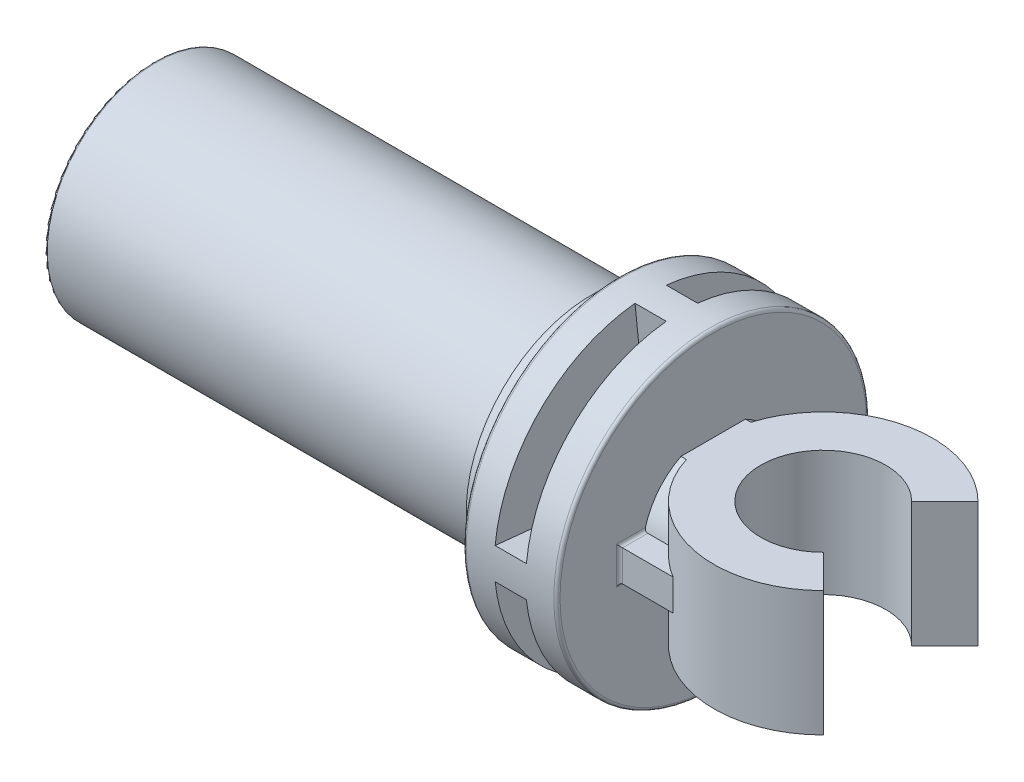
from build123d import *
from build123d.topology import SkipClean

# Parameters (mm, degrees)
SCHIZZO1_R                    = 3.5
ESTRUSIONE_ESTRUSIONE1_DEPTH  = 14
SCHIZZO2_R                    = 4
ESTRUSIONE_ESTRUSIONE2_DEPTH  = 0.9
SCHIZZO3_R                    = 5
ESTRUSIONE_ESTRUSIONE3_DEPTH  = 1
SCHIZZO4_R                    = 3.5
ESTRUSIONE_ESTRUSIONE4_DEPTH  = 1
SCHIZZO5_R                    = 5
ESTRUSIONE_ESTRUSIONE5_DEPTH  = 1
SCHIZZO6_W                    = 1
SCHIZZO6_H                    = 2
RIVOLUZIONE1_ANGLE            = 11.5
RIPETIZIONECIRCOLARE1_COUNT   = 4
SCHIZZO8_R                    = 3
TAGLIO_ESTRUSIONE2_DEPTH      = 14.9
SCHIZZO10_W                   = 10.9
SCHIZZO10_H                   = 2
TAGLIO_ESTRUSIONE3_DEPTH      = 20.246038553
SCHIZZO11_R                   = 2
TAGLIO_ESTRUSIONE5_DEPTH      = 1
SCHIZZO12_R                   = 2.25
ESTRUSIONE_ESTRUSIONE14_DEPTH = 1
ESTRUSIONE_ESTRUSIONE18_DEPTH = 2
ESTRUSIONE_ESTRUSIONE15_DEPTH = 0.5
SCHIZZO15_W                   = 1
SCHIZZO15_H                   = 2.061552812
TAGLIO_ESTRUSIONE6_DEPTH      = 1
RACCORDO1_R                   = 0.1
RACCORDO4_R                   = 0.1
RACCORDO5_R                   = 0.1
RACCORDO6_R                   = 0.1
RACCORDO7_R                   = 0.1


with BuildPart() as part:
    # Schizzo1 → Estrusione-Estrusione1 (new body)
    with BuildSketch(Plane(origin=(0, 0, 0), x_dir=(0, 0, -1), z_dir=(1, 0, 0))):
        Circle(SCHIZZO1_R)
    extrude(amount=ESTRUSIONE_ESTRUSIONE1_DEPTH)

    # Schizzo2 → Estrusione-Estrusione2 (add)
    with BuildSketch(Plane(origin=(14, 0, 0), x_dir=(0, 0, -1), z_dir=(1, 0, 0))):
        Circle(SCHIZZO2_R)
    extrude(amount=ESTRUSIONE_ESTRUSIONE2_DEPTH)

    # Schizzo3 → Estrusione-Estrusione3 (add)
    with BuildSketch(Plane(origin=(14.9, 0, 0), x_dir=(0, 0, -1), z_dir=(1, 0, 0))):
        Circle(SCHIZZO3_R)
    extrude(amount=ESTRUSIONE_ESTRUSIONE3_DEPTH)

    # Schizzo4 → Estrusione-Estrusione4 (add)
    with BuildSketch(Plane(origin=(15.9, 0, 0), x_dir=(0, 0, -1), z_dir=(1, 0, 0))):
        Circle(SCHIZZO4_R)
    extrude(amount=ESTRUSIONE_ESTRUSIONE4_DEPTH)

    # Schizzo5 → Estrusione-Estrusione5 (add)
    with BuildSketch(Plane(origin=(16.9, 0, 0), x_dir=(0, 0, -1), z_dir=(1, 0, 0))):
        Circle(SCHIZZO5_R)
    extrude(amount=ESTRUSIONE_ESTRUSIONE5_DEPTH)

    # Schizzo6 → Rivoluzione1 (revolve, symmetric)
    with SkipClean():  # the faces are left unmerged after this step: merging them gives an invalid solid
        with BuildSketch(Plane(origin=(0, 0, 0), x_dir=(1, 0, 0), z_dir=(0, 1, 0))) as rivoluzione1_sk:
            with Locations((16.4, 4)):
                Rectangle(SCHIZZO6_W, SCHIZZO6_H)
        rivoluzione1 = revolve(axis=Axis((0, 0, 0), (1, 0, 0)), revolution_arc=RIVOLUZIONE1_ANGLE / 2)
        rivoluzione1 = rivoluzione1 + revolve(rivoluzione1_sk.sketch, axis=Axis((0, 0, 0), (-1, 0, 0)), revolution_arc=RIVOLUZIONE1_ANGLE / 2)

    # RipetizioneCircolare1: Rivoluzione1 ×4 about axis
    with SkipClean():  # the faces are left unmerged after this step: merging them gives an invalid solid
        ripetizionecircolare1_axis = Axis((0, 0, 0), (-1, 0, 0))
        for i in range(1, RIPETIZIONECIRCOLARE1_COUNT):
            add(rivoluzione1.rotate(ripetizionecircolare1_axis, i * 360 / RIPETIZIONECIRCOLARE1_COUNT))

    # Schizzo8 → Taglio-Estrusione2 (cut)
    with SkipClean():  # the faces are left unmerged after this step: merging them gives an invalid solid
        with BuildSketch(Plane.ZY):
            Circle(SCHIZZO8_R)
        extrude(amount=-TAGLIO_ESTRUSIONE2_DEPTH, mode=Mode.SUBTRACT)

    # Schizzo10 → Taglio-Estrusione3 (cut, through all)
    with SkipClean():  # the faces are left unmerged after this step: merging them gives an invalid solid
        with BuildSketch(Plane(origin=(0, 0, 0), x_dir=(1, 0, 0), z_dir=(0, 1, 0))):
            with Locations((9.45, 0)):
                Rectangle(SCHIZZO10_W, SCHIZZO10_H)
        extrude(amount=-TAGLIO_ESTRUSIONE3_DEPTH, mode=Mode.SUBTRACT)

    # Schizzo11 → Taglio-Estrusione5 (cut)
    with SkipClean():  # the faces are left unmerged after this step: merging them gives an invalid solid
        with BuildSketch(Plane.ZY.offset(-14.9)):
            Circle(SCHIZZO11_R)
        extrude(amount=-TAGLIO_ESTRUSIONE5_DEPTH, mode=Mode.SUBTRACT)

    # Schizzo12 → Estrusione-Estrusione14 (add)
    with SkipClean():  # the faces are left unmerged after this step: merging them gives an invalid solid
        with BuildSketch(Plane(origin=(17.9, 0, 0), x_dir=(0, 0, -1), z_dir=(1, 0, 0))):
            Circle(SCHIZZO12_R)
        extrude(amount=ESTRUSIONE_ESTRUSIONE14_DEPTH)

    # Schizzo13 → Estrusione-Estrusione18 (add, symmetric)
    with SkipClean():  # the faces are left unmerged after this step: merging them gives an invalid solid
        with BuildSketch(Plane(origin=(0, 0, 0), x_dir=(1, 0, 0), z_dir=(0, 1, 0))):
            with BuildLine():
                Line((22.836535342, 1.410464334), (23.9, 2.468312584))
                ThreePointArc((23.9, 2.468312584), (17.918582464, 0), (23.9, -2.468312584))
                Line((23.9, -2.468312584), (22.836535342, -1.410464334))
                ThreePointArc((22.836535342, -1.410464334), (19.418582464, 0), (22.836535342, 1.410464334))
            make_face()
        extrude(amount=ESTRUSIONE_ESTRUSIONE18_DEPTH, both=True)

    # Schizzo14 → Estrusione-Estrusione15 (add, symmetric)
    with SkipClean():  # the faces are left unmerged after this step: merging them gives an invalid solid
        with BuildSketch(Plane(origin=(0, 0, 0), x_dir=(1, 0, 0), z_dir=(0, 1, 0))):
            Polygon((17.9, 0), (17.9, 3), (19.615806827, 3), align=None)
        estrusione_estrusione15 = extrude(amount=ESTRUSIONE_ESTRUSIONE15_DEPTH, both=True)

    # Specchia2: Estrusione-Estrusione15 across plane
    with SkipClean():  # the faces are left unmerged after this step: merging them gives an invalid solid
        add(estrusione_estrusione15.mirror(Plane.XY))

    # Schizzo15 → Taglio-Estrusione6 (cut)
    with SkipClean():  # the faces are left unmerged after this step: merging them gives an invalid solid
        with BuildSketch(Plane(origin=(0, 2, 0), x_dir=(1, 0, 0), z_dir=(0, 1, 0))):
            with Locations((18.4, 0)):
                Rectangle(SCHIZZO15_W, SCHIZZO15_H)
        taglio_estrusione6 = extrude(amount=TAGLIO_ESTRUSIONE6_DEPTH, mode=Mode.SUBTRACT)

    # Specchia3: Taglio-Estrusione6 across plane
    with SkipClean():  # the faces are left unmerged after this step: merging them gives an invalid solid
        add(taglio_estrusione6.mirror(Plane.ZX), mode=Mode.SUBTRACT)

    # Raccordo1
    raccordo1_edges = [part.edges().sort_by_distance(p)[0] for p in [
        (17.9, 0, 5),
        (14.9, 3.872983346, 3.16227766),
    ]]
    fillet(raccordo1_edges, radius=RACCORDO1_R)

    # Raccordo4
    raccordo4_edges = [part.edges().sort_by_distance(p)[0] for p in [
        (17.9, -0.5, -2.596870548),
        (17.9, 0, -3),
        (17.9, 0.5, -2.596870548),
        (17.9, 0.5, 2.596870548),
        (17.9, 0, 3),
        (17.9, -0.5, 2.596870548),
    ]]
    fillet(raccordo4_edges, radius=RACCORDO4_R)

    # Raccordo5
    raccordo5_edges = [part.edges().sort_by_distance(p)[0] for p in [
        (0, 0, 3.5),
    ]]
    fillet(raccordo5_edges, radius=RACCORDO5_R)

    # Raccordo6
    raccordo6_edges = [part.edges().sort_by_distance(p)[0] for p in [
        (0, 0, -3),
    ]]
    fillet(raccordo6_edges, radius=RACCORDO6_R)

    # Raccordo7
    raccordo7_edges = [part.edges().sort_by_distance(p)[0] for p in [
        (14, 2.80624304, 2.091650066),
    ]]
    fillet(raccordo7_edges, radius=RACCORDO7_R)


solid = part.part
